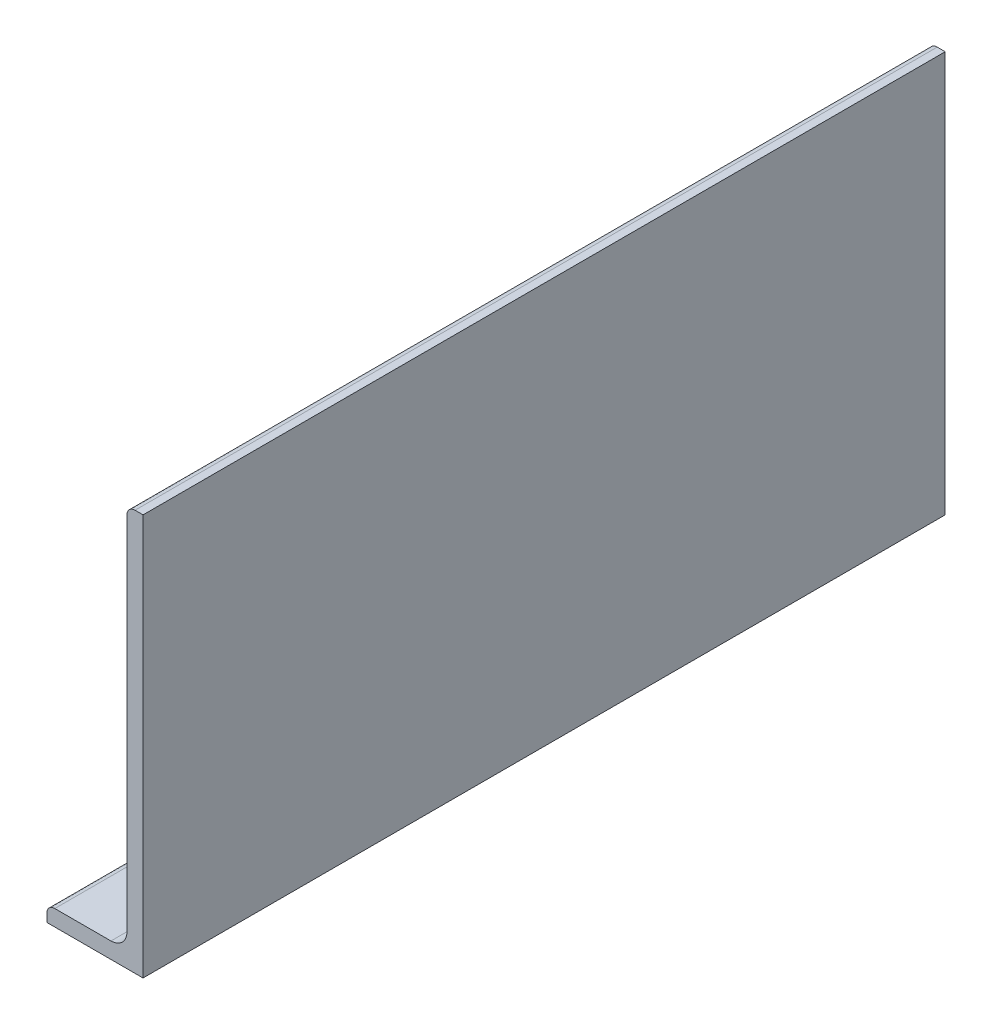
from build123d import *

# Parameters (mm, degrees)
BOSS_EXTRUDE1_DEPTH = 100
FILLET2_R           = 1
FILLET3_R           = 2
SKETCH3_R           = 1.6
CUT_EXTRUDE1_DEPTH  = 214.782256883


with BuildPart() as part:
    # Sketch2 → Boss-Extrude1 (new body)
    with BuildSketch(Plane.XY):
        Polygon((182.753531726, 24.828838313), (182.753531726, -25.171161687), (170.753531726, -25.171161687), (170.753531726, -23.171161687), (180.753531726, -23.171161687), (180.753531726, 24.828838313), align=None)
    extrude(amount=BOSS_EXTRUDE1_DEPTH)

    # Fillet2
    fillet2_edges = [part.edges().sort_by_distance(p)[0] for p in [
        (170.753531726, -23.171161687, 50),
        (180.753531726, 24.828838313, 50),
    ]]
    fillet(fillet2_edges, radius=FILLET2_R)

    # Fillet3
    fillet3_edges = [part.edges().sort_by_distance(p)[0] for p in [
        (180.753531726, -23.171161687, 50),
    ]]
    fillet(fillet3_edges, radius=FILLET3_R)

    # Sketch3 → Cut-Extrude1 (cut, through all)
    with BuildSketch(Plane(origin=(0, -23.171161687, 0), x_dir=(1, 0, 0), z_dir=(0, 1, 0))):
        with Locations(Location((175.253531726, -80, 0), (0, 0, 270))):
            Circle(SKETCH3_R)
        with Locations(Location((175.253531726, -20, 0), (0, 0, 270))):
            Circle(SKETCH3_R)
    extrude(amount=-CUT_EXTRUDE1_DEPTH, mode=Mode.SUBTRACT)


solid = part.part
